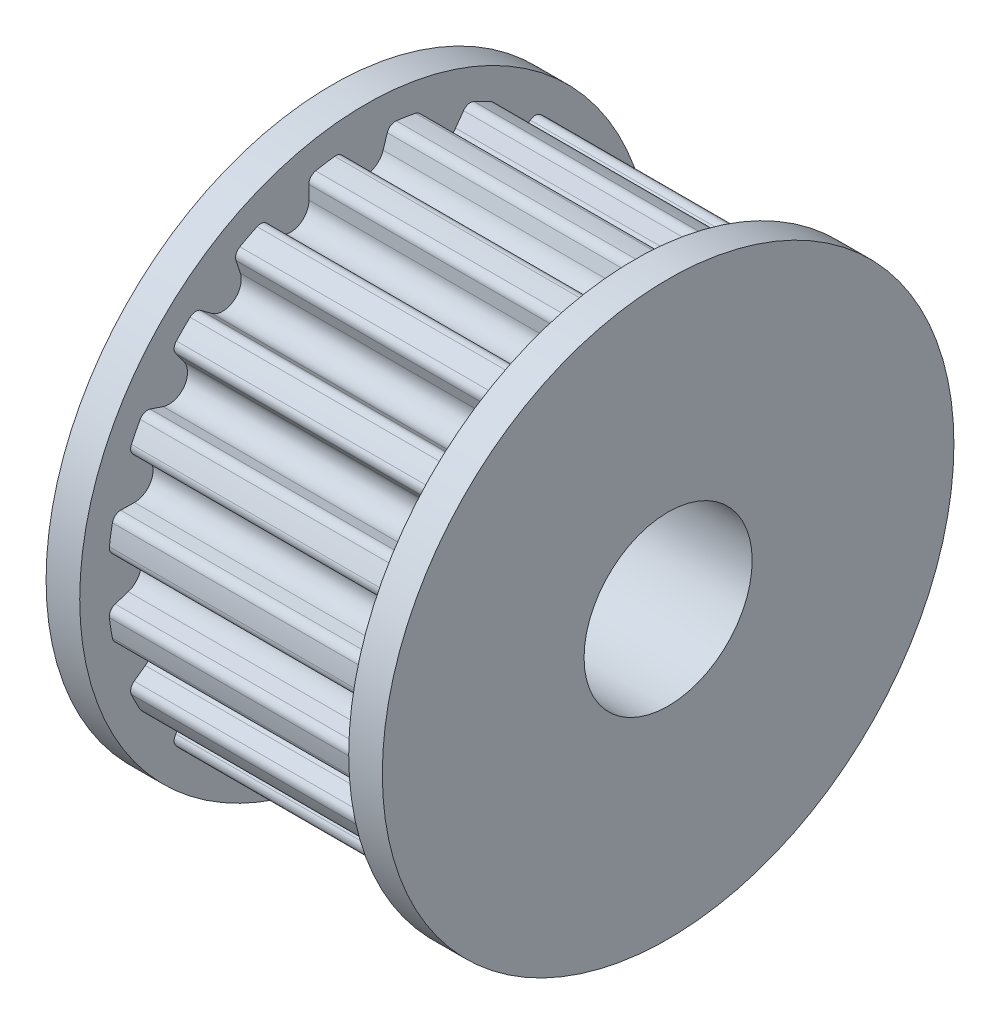
from build123d import *
from build123d.topology import SkipClean

# Parameters (mm, degrees)
SKETCH_1_W               = 16
SKETCH_1_H               = 10.345
SKETCH_4_W               = 2
SKETCH_4_H               = 1.101020514
CUT_EXTRUDE_1_DEPTH      = 27.961788702
CUT_EXTRUDE_2_REACH      = 28.962
PATTERN_CIRCULAR_3_COUNT = 20
EXTRUDE_START            = 2
SKETCH_7_R               = 17
EXTRUDE_1_DEPTH          = 2
SKETCH_8_R               = 17
EXTRUDE_2_DEPTH          = 2
EXTRUDE_START_2          = -20
EXTRUDE_3_DEPTH          = 20


with BuildPart() as part:
    # 草图1 → 旋转1 (revolve)
    with BuildSketch(Plane.XY, mode=Mode.PRIVATE) as revolve_1_sk:
        with Locations((8, 10.1725)):
            Rectangle(SKETCH_1_W, SKETCH_1_H)
    revolve(revolve_1_sk.sketch.rotate(Axis((0, 0, 0), (1, 0, 0)), 90), axis=Axis((0, 0, 0), (1, 0, 0)))

    # 草图4 → 切除-拉伸1 (cut, through all)
    with BuildSketch(Plane.ZY):
        with Locations((0, 5.449489743)):
            Rectangle(SKETCH_4_W, SKETCH_4_H)
    extrude(amount=-CUT_EXTRUDE_1_DEPTH, mode=Mode.SUBTRACT)

    # 草图6 → 切除-拉伸2 (cut, up to next)
    with BuildSketch(Plane(origin=(0, 0, 0), x_dir=(0, 0, -1), z_dir=(1, 0, 0)), mode=Mode.PRIVATE) as cut_extrude_2_sk1:
        with BuildLine():
            Line((1.29350436, 14.889411229), (1.049088646, 14.114223621))
            ThreePointArc((1.049088646, 14.114223621), (0, 13.345), (-1.049088646, 14.114223621))
            Line((-1.049088646, 14.114223621), (-1.29350436, 14.889411229))
            ThreePointArc((-1.29350436, 14.889411229), (-1.499322423, 15.159221505), (-1.829991088, 15.235490068))
            ThreePointArc((-1.829991088, 15.235490068), (-2.077964077, 15.203653847), (-2.325385479, 15.167781887))
            Line((-2.325385479, 15.167781887), (-2.810603409, 16.706696553))
            ThreePointArc((-2.810603409, 16.706696553), (0, 16.941463964), (2.810603409, 16.706696553))
            Line((2.810603409, 16.706696553), (2.325385479, 15.167781887))
            ThreePointArc((2.325385479, 15.167781887), (2.077964077, 15.203653847), (1.829991088, 15.235490068))
            ThreePointArc((1.829991088, 15.235490068), (1.499322423, 15.159221505), (1.29350436, 14.889411229))
        make_face()
    cut_extrude_2_tool1 = extrude(cut_extrude_2_sk1.sketch, amount=CUT_EXTRUDE_2_REACH, mode=Mode.PRIVATE) & part.part
    cut_extrude_2 = cut_extrude_2_tool1.solids().sort_by_distance((0, 15.551967, 0))[0]
    add(cut_extrude_2, mode=Mode.SUBTRACT)

    # 阵列(圆周)3: 切除-拉伸2 ×20 about axis
    pattern_circular_3_axis = Axis((0, 0, 0), (1, 0, 0))
    for i in range(1, PATTERN_CIRCULAR_3_COUNT):
        add(cut_extrude_2.rotate(pattern_circular_3_axis, i * 360 / PATTERN_CIRCULAR_3_COUNT), mode=Mode.SUBTRACT)

    # 草图7 → 凸台-拉伸1 (add)
    with BuildSketch(Plane.ZY.offset(EXTRUDE_START)):
        Circle(SKETCH_7_R)
        with BuildLine():
            Line((-1, 6), (-1, 4.898979486))
            ThreePointArc((-1, 4.898979486), (0, -5), (1, 4.898979486))
            Line((1, 4.898979486), (1, 6))
            Line((1, 6), (-1, 6))
        make_face(mode=Mode.SUBTRACT)
    extrude(amount=-EXTRUDE_1_DEPTH)

    # 草图8 → 凸台-拉伸2 (add)
    with BuildSketch(Plane(origin=(16, 0, 0), x_dir=(0, 0, -1), z_dir=(1, 0, 0))):
        with Locations(Location((0, 0, 0), (0, 0, 180))):
            Circle(SKETCH_8_R)
        with BuildLine():
            Line((1, 6), (1, 4.898979486))
            ThreePointArc((1, 4.898979486), (0, -5), (-1, 4.898979486))
            Line((-1, 4.898979486), (-1, 6))
            Line((-1, 6), (1, 6))
        make_face(mode=Mode.SUBTRACT)
    extrude(amount=EXTRUDE_2_DEPTH)

    # 草图9 → 凸台-拉伸3 (add)
    with SkipClean():  # the faces are left unmerged after this step: merging them gives an invalid solid
        with BuildSketch(Plane(origin=(18, 0, 0), x_dir=(0, 0, -1), z_dir=(1, 0, 0)).offset(EXTRUDE_START_2)):
            with BuildLine():
                Line((-1, 4.898979486), (-1, 6))
                Line((-1, 6), (1, 6))
                Line((1, 6), (1, 4.898979486))
                ThreePointArc((1, 4.898979486), (0, 5), (-1, 4.898979486))
            make_face()
        extrude(amount=EXTRUDE_3_DEPTH)


solid = part.part
